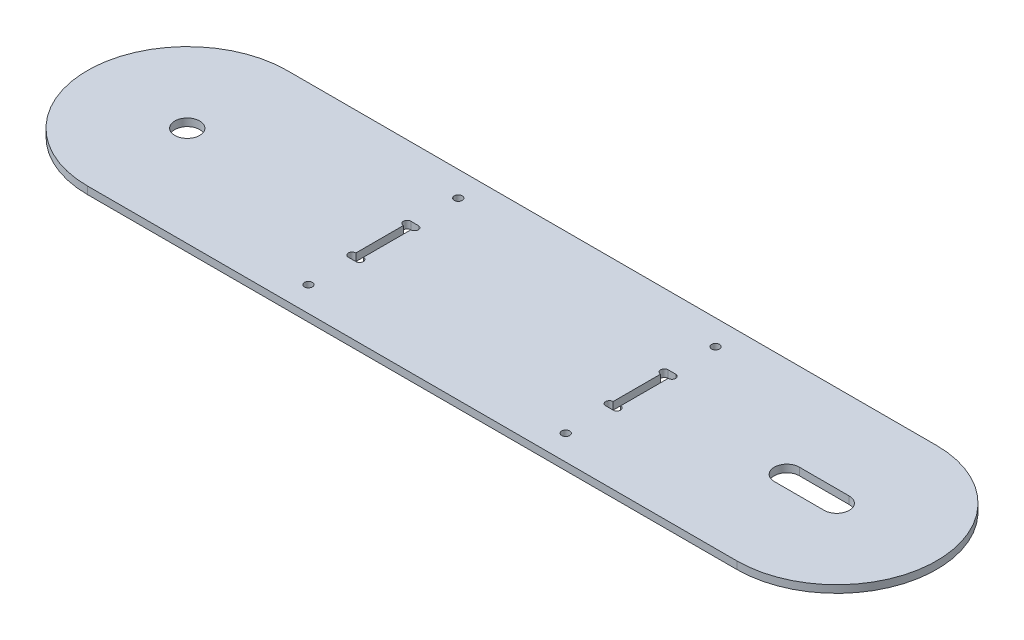
from build123d import *

# Parameters (mm, degrees)
SKETCH1_R           = 5
BOSS_EXTRUDE1_DEPTH = 3
SKETCH2_R           = 1.6
CUT_EXTRUDE1_DEPTH  = 303.669787062


with BuildPart() as part:
    # Sketch1 → Boss-Extrude1 (new body)
    with BuildSketch(Plane(origin=(0, 0, 0), x_dir=(1, 0, 0), z_dir=(0, 1, 0))):
        with BuildLine():
            Line((0, 40), (260, 40))
            ThreePointArc((260, 40), (300, 0), (260, -40))
            Line((260, -40), (0, -40))
            ThreePointArc((0, -40), (-40, 0), (0, 40))
        make_face()
        with Locations(Location((0, 0, 0), (0, 0, 270))):
            Circle(SKETCH1_R, mode=Mode.SUBTRACT)
        with BuildLine():
            Line((260, -5), (240, -5))
            ThreePointArc((240, -5), (235, 0), (240, 5))
            Line((240, 5), (260, 5))
            ThreePointArc((260, 5), (265, 0), (260, -5))
        make_face(mode=Mode.SUBTRACT)
    extrude(amount=BOSS_EXTRUDE1_DEPTH)

    # Sketch2 → Cut-Extrude1 (cut, through all)
    with BuildSketch(Plane(origin=(0, 3, 0), x_dir=(1, 0, 0), z_dir=(0, 1, 0))):
        with Locations(Location((78.5, 30, 0), (0, 0, 270))):
            Circle(SKETCH2_R)
        with Locations(Location((78.5, -30, 0), (0, 0, 270))):
            Circle(SKETCH2_R)
        with Locations(Location((181.5, -30, 0), (0, 0, 90))):
            Circle(SKETCH2_R)
        with Locations(Location((181.5, 30, 0), (0, 0, 90))):
            Circle(SKETCH2_R)
        with BuildLine():
            Line((80, 9.5), (80, -9.5))
            ThreePointArc((80, -9.5), (81.5, -11), (80, -12.5))
            Line((80, -12.5), (77, -12.5))
            ThreePointArc((77, -12.5), (75.5, -11), (77, -9.5))
            Line((77, -9.5), (77, 9.5))
            ThreePointArc((77, 9.5), (75.5, 11), (77, 12.5))
            Line((77, 12.5), (80, 12.5))
            ThreePointArc((80, 12.5), (81.5, 11), (80, 9.5))
        make_face()
        with BuildLine():
            Line((183, 12.5), (180, 12.5))
            ThreePointArc((180, 12.5), (178.5, 11), (180, 9.5))
            Line((180, 9.5), (180, -9.5))
            ThreePointArc((180, -9.5), (178.5, -11), (180, -12.5))
            Line((180, -12.5), (183, -12.5))
            ThreePointArc((183, -12.5), (184.5, -11), (183, -9.5))
            Line((183, -9.5), (183, 9.5))
            ThreePointArc((183, 9.5), (184.5, 11), (183, 12.5))
        make_face()
    extrude(amount=-CUT_EXTRUDE1_DEPTH, mode=Mode.SUBTRACT)


solid = part.part
